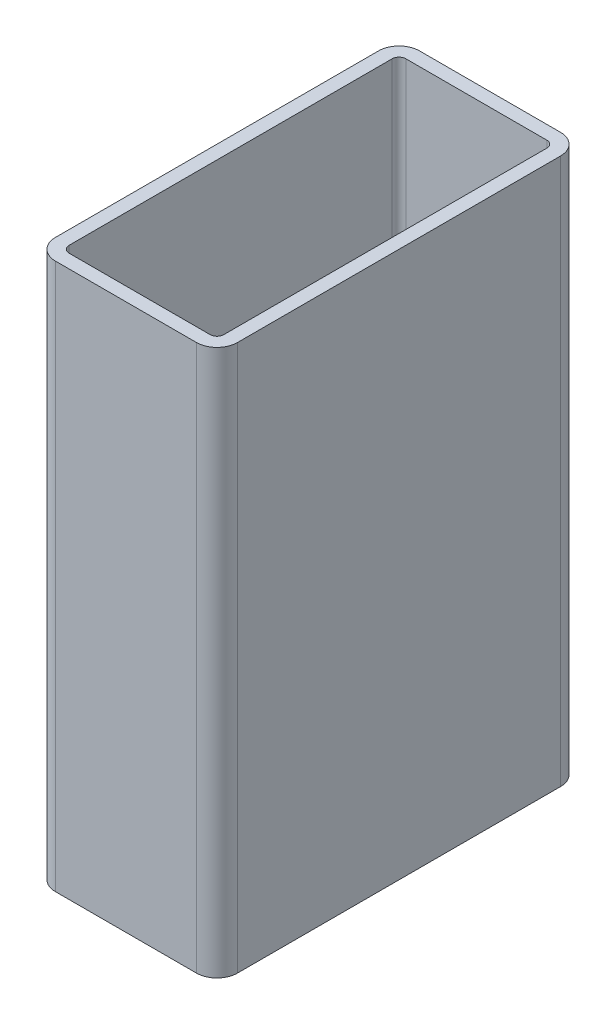
from build123d import *

# Parameters (mm, degrees)
EXTRUDE_1_DEPTH = 30


with BuildPart() as part:
    # Эскиз1 → Бобышка-Вытянуть1 (new, symmetric)
    with BuildSketch(Plane(origin=(0, 0, 0), x_dir=(1, 0, 0), z_dir=(0, 1, 0))):
        with BuildLine():
            Line((-7.75, -20), (7.75, -20))
            ThreePointArc((7.75, -20), (9.340990258, -19.340990258), (10, -17.75))
            Line((10, -17.75), (10, 17.75))
            ThreePointArc((10, 17.75), (9.340990258, 19.340990258), (7.75, 20))
            Line((7.75, 20), (-7.75, 20))
            ThreePointArc((-7.75, 20), (-9.340990258, 19.340990258), (-10, 17.75))
            Line((-10, 17.75), (-10, -17.75))
            ThreePointArc((-10, -17.75), (-9.340990258, -19.340990258), (-7.75, -20))
        make_face()
        with BuildLine():
            Line((-7.75, 18.5), (7.75, 18.5))
            ThreePointArc((7.75, 18.5), (8.280330086, 18.280330086), (8.5, 17.75))
            Line((8.5, 17.75), (8.5, -17.75))
            ThreePointArc((8.5, -17.75), (8.280330086, -18.280330086), (7.75, -18.5))
            Line((7.75, -18.5), (-7.75, -18.5))
            ThreePointArc((-7.75, -18.5), (-8.280330086, -18.280330086), (-8.5, -17.75))
            Line((-8.5, -17.75), (-8.5, 17.75))
            ThreePointArc((-8.5, 17.75), (-8.280330086, 18.280330086), (-7.75, 18.5))
        make_face(mode=Mode.SUBTRACT)
    extrude(amount=EXTRUDE_1_DEPTH, both=True)


solid = part.part
